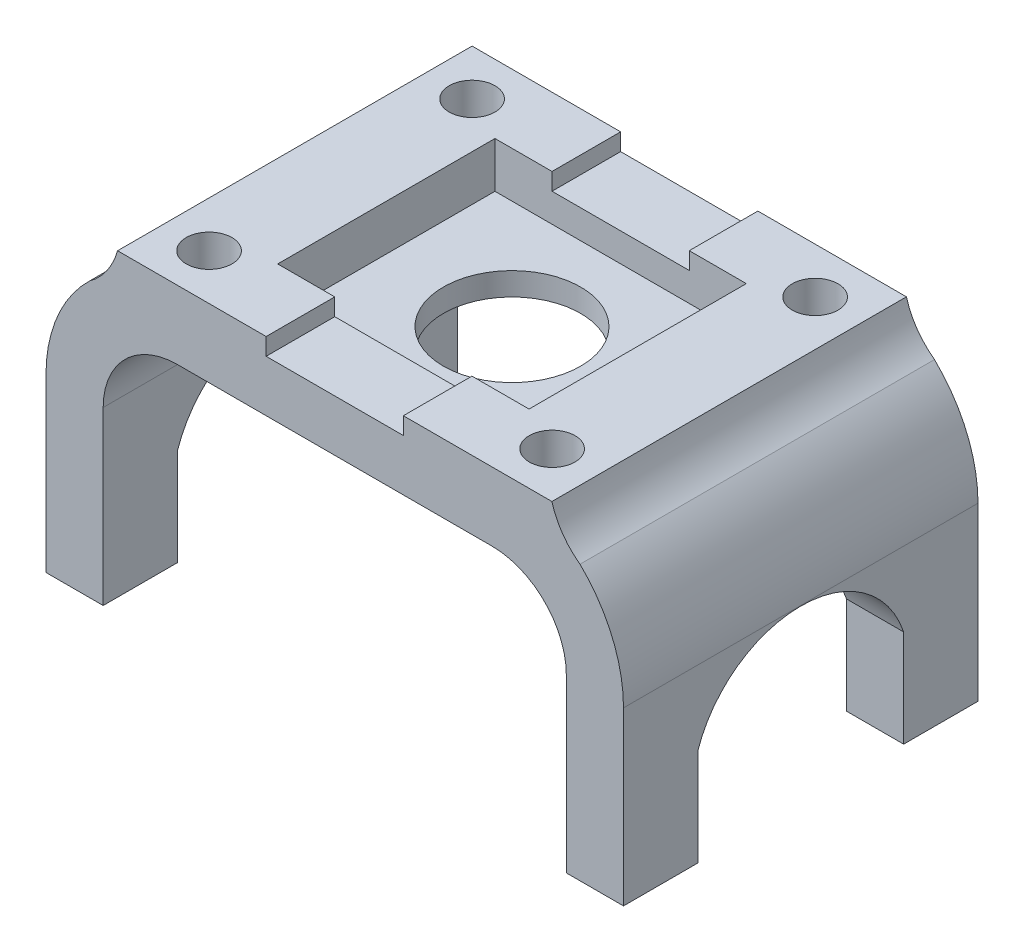
from build123d import *

# Parameters (mm, degrees)
SCHIZZO1_W                   = 101
SCHIZZO1_H                   = 55
ESTRUSIONE_ESTRUSIONE1_DEPTH = 62
TAGLIO_ESTRUSIONE1_DEPTH     = 131.652210085
TAGLIO_ESTRUSIONE2_DEPTH     = 131.652210085
TAGLIO_ESTRUSIONE4_DEPTH     = 131.652210085
SCHIZZO8_W                   = 24
SCHIZZO8_H                   = 62
TAGLIO_ESTRUSIONE5_DEPTH     = 3
SCHIZZO9_W                   = 43.960031948
SCHIZZO9_H                   = 38
TAGLIO_ESTRUSIONE6_DEPTH     = 8
SCHIZZO10_R                  = 12
TAGLIO_ESTRUSIONE7_DEPTH     = 128.491176165
SCHIZZO11_R                  = 4
TAGLIO_ESTRUSIONE8_DEPTH     = 131.652210085


with BuildPart() as part:
    # Schizzo1 → Estrusione-Estrusione1 (new body)
    with BuildSketch(Plane.XY):
        with Locations((-50.5, 27.5)):
            Rectangle(SCHIZZO1_W, SCHIZZO1_H)
    extrude(amount=-ESTRUSIONE_ESTRUSIONE1_DEPTH)

    # Schizzo2 → Taglio-Estrusione1 (cut, through all)
    with BuildSketch(Plane(origin=(0, 0, 0), x_dir=(0, 0, -1), z_dir=(1, 0, 0))):
        with BuildLine():
            Line((13, 0), (49, 0))
            Line((49, 0), (49, 17))
            ThreePointArc((49, 17), (31, 29.91723747), (13, 17))
            Line((13, 17), (13, 0))
        make_face()
    extrude(amount=-TAGLIO_ESTRUSIONE1_DEPTH, mode=Mode.SUBTRACT)

    # Schizzo3 → Taglio-Estrusione2 (cut, through all)
    with BuildSketch(Plane.XY):
        with BuildLine():
            Line((-91, 0), (-10, 0))
            Line((-10, 0), (-10, 30))
            ThreePointArc((-10, 30), (-13.807611845, 39.192388155), (-23, 43))
            Line((-23, 43), (-78, 43))
            ThreePointArc((-78, 43), (-87.192388155, 39.192388155), (-91, 30))
            Line((-91, 30), (-91, 0))
        make_face()
    extrude(amount=-TAGLIO_ESTRUSIONE2_DEPTH, mode=Mode.SUBTRACT)

    # Schizzo7 → Taglio-Estrusione4 (cut, through all)
    with BuildSketch(Plane.XY):
        with BuildLine():
            Line((0, 55), (0, 30))
            ThreePointArc((0, 30), (-1.980372958, 39.751757321), (-7.607741667, 47.958545322))
            ThreePointArc((-7.607741667, 47.958545322), (-10.661934927, 51.062047082), (-12.519984026, 55))
            Line((-12.519984026, 55), (0, 55))
        make_face()
        with BuildLine():
            Line((-101, 55), (-101, 30))
            ThreePointArc((-101, 30), (-99.019627042, 39.751757321), (-93.392258333, 47.958545322))
            ThreePointArc((-93.392258333, 47.958545322), (-90.338065073, 51.062047082), (-88.480015974, 55))
            Line((-88.480015974, 55), (-101, 55))
        make_face()
    extrude(amount=-TAGLIO_ESTRUSIONE4_DEPTH, mode=Mode.SUBTRACT)

    # Schizzo8 → Taglio-Estrusione5 (cut)
    with BuildSketch(Plane(origin=(0, 55, 0), x_dir=(1, 0, 0), z_dir=(0, 1, 0))):
        with Locations((-50.5, 31)):
            Rectangle(SCHIZZO8_W, SCHIZZO8_H)
    extrude(amount=-TAGLIO_ESTRUSIONE5_DEPTH, mode=Mode.SUBTRACT)

    # Schizzo9 → Taglio-Estrusione6 (cut)
    with BuildSketch(Plane(origin=(0, 55, 0), x_dir=(1, 0, 0), z_dir=(0, 1, 0))):
        with Locations((-50.5, 31)):
            Rectangle(SCHIZZO9_W, SCHIZZO9_H)
    extrude(amount=-TAGLIO_ESTRUSIONE6_DEPTH, mode=Mode.SUBTRACT)

    # Schizzo10 → Taglio-Estrusione7 (cut, through all)
    with BuildSketch(Plane(origin=(0, 47, 0), x_dir=(1, 0, 0), z_dir=(0, 1, 0))):
        with Locations(Location((-50.5, 31, 0), (0, 0, 270))):
            Circle(SCHIZZO10_R)
    extrude(amount=-TAGLIO_ESTRUSIONE7_DEPTH, mode=Mode.SUBTRACT)

    # Schizzo11 → Taglio-Estrusione8 (cut, through all)
    with BuildSketch(Plane(origin=(0, 55, 0), x_dir=(1, 0, 0), z_dir=(0, 1, 0))):
        with Locations(Location((-80.480015974, 54, 0), (0, 0, 180))):
            Circle(SCHIZZO11_R)
        with Locations(Location((-20.480015974, 54, 0), (0, 0, 180))):
            Circle(SCHIZZO11_R)
        with Locations(Location((-20.480015974, 8, 0), (0, 0, 180))):
            Circle(SCHIZZO11_R)
        with Locations(Location((-80.480015974, 8, 0), (0, 0, 180))):
            Circle(SCHIZZO11_R)
    extrude(amount=-TAGLIO_ESTRUSIONE8_DEPTH, mode=Mode.SUBTRACT)


solid = part.part
